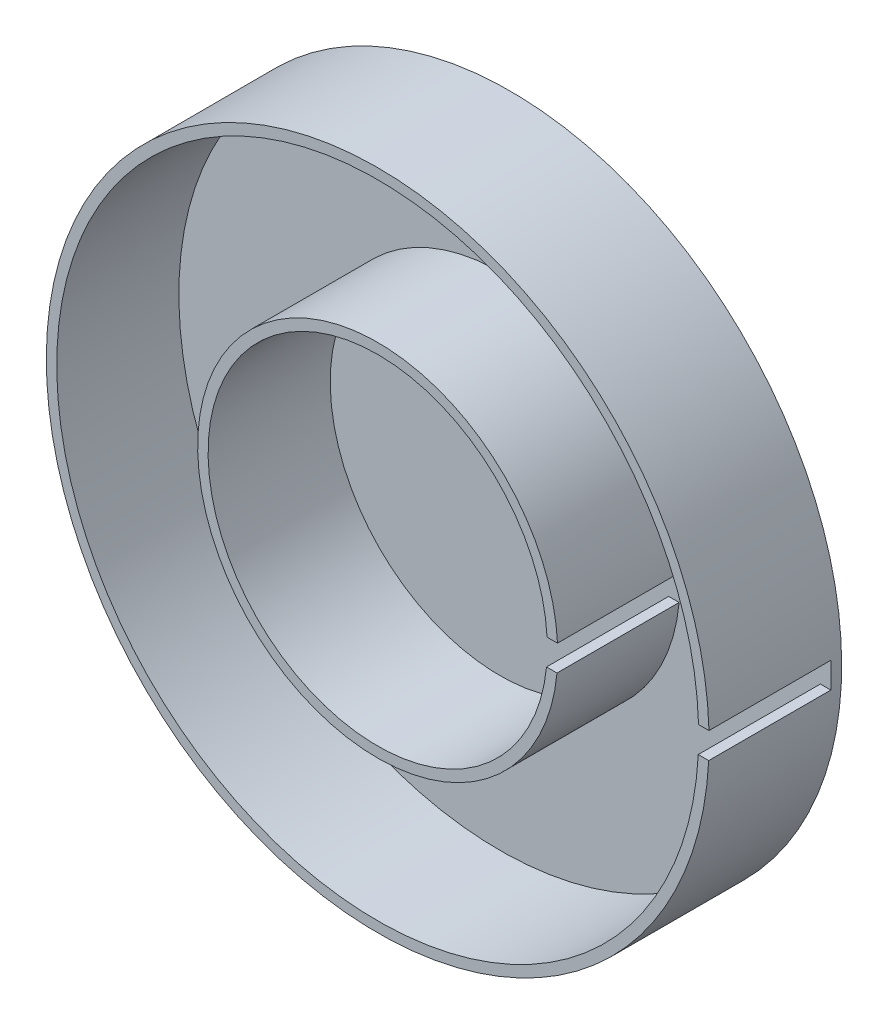
from build123d import *

# Parameters (mm, degrees)
SKETCH2_R           = 63.5
BOSS_EXTRUDE1_DEPTH = 25.4
SHELL1_T            = -2
BOSS_EXTRUDE2_DEPTH = 23.4
CUT_EXTRUDE2_DEPTH  = 23.4


with BuildPart() as part:
    # Sketch2 → Boss-Extrude1 (new body)
    with BuildSketch(Plane(origin=(0, 0, 0), x_dir=(0, 1, 0), z_dir=(0, 0, 1))):
        with Locations(Location((0, 0, 0), (0, 0, 270))):
            Circle(SKETCH2_R)
    extrude(amount=BOSS_EXTRUDE1_DEPTH)

    # Shell1
    shell1_openings = [part.faces().sort_by_distance(p)[0] for p in [
        (0, 0, 25.4),
    ]]
    offset(amount=SHELL1_T, openings=shell1_openings, kind=Kind.INTERSECTION)

    # Sketch3 → Boss-Extrude2 (add)
    with BuildSketch(Plane.XY.offset(2)):
        with BuildLine():
            Line((32.449501385, 1.811038348), (34.452433007, 1.811038348))
            ThreePointArc((34.452433007, 1.811038348), (-34.49308373, 0.690778407), (34.352300121, -3.188961652))
            Line((34.352300121, -3.188961652), (32.343168113, -3.188961652))
            ThreePointArc((32.343168113, -3.188961652), (-32.492653095, 0.691010021), (32.449501385, 1.811038348))
        make_face()
    extrude(amount=BOSS_EXTRUDE2_DEPTH)

    # Sketch4 → Cut-Extrude2 (cut)
    with BuildSketch(Plane.XY.offset(25.4)):
        Polygon((34.352300121, -3.188961652), (63.419874831, -3.188961652), (70.082181446, -0.688961652), (63.474169078, 1.811038348), (34.452433007, 1.811038348), align=None)
    extrude(amount=-CUT_EXTRUDE2_DEPTH, mode=Mode.SUBTRACT)


solid = part.part
